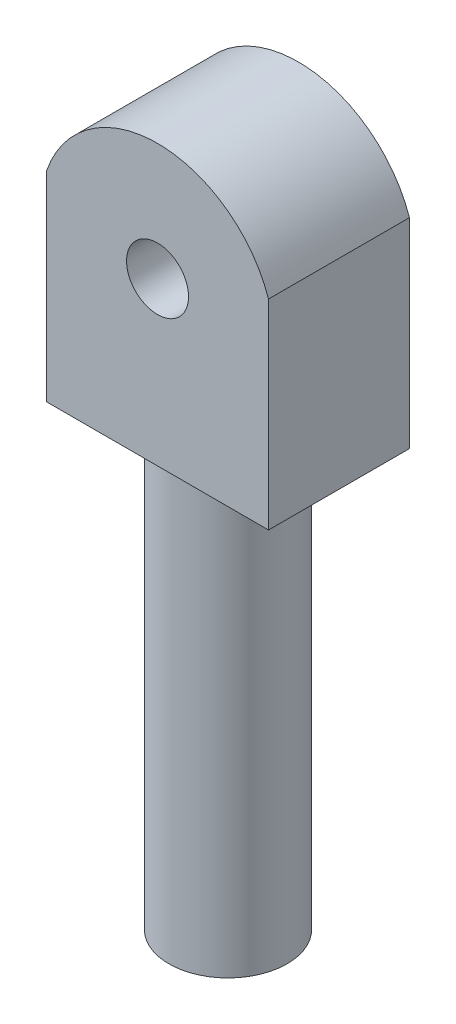
from build123d import *

# Parameters (mm, degrees)
SKETCH1_R           = 1.1176
BOSS_EXTRUDE1_DEPTH = 5.08
SKETCH2_R           = 1.0922
CUT_EXTRUDE1_DEPTH  = 15.748
SKETCH3_W           = 8.001
SKETCH3_H           = 5.08
SKETCH3_R           = 2.131785714
CUT_EXTRUDE2_DEPTH  = 15.748


with BuildPart() as part:
    # Sketch1 → Boss-Extrude1 (new body)
    with BuildSketch(Plane.XY):
        with BuildLine():
            Line((4.0005, -21.59), (4.0005, 1.368360053))
            ThreePointArc((4.0005, 1.368360053), (0, 4.228050317), (-4.0005, 1.368360053))
            Line((-4.0005, 1.368360053), (-4.0005, -21.59))
            Line((-4.0005, -21.59), (4.0005, -21.59))
        make_face()
        Circle(SKETCH1_R, mode=Mode.SUBTRACT)
    extrude(amount=BOSS_EXTRUDE1_DEPTH)

    # Sketch2 → Cut-Extrude1 (cut)
    with BuildSketch(Plane.XZ.offset(21.59)):
        with Locations(Location((0, 2.54, 0), (0, 0, 270))):
            Circle(SKETCH2_R)
    extrude(amount=-CUT_EXTRUDE1_DEPTH, mode=Mode.SUBTRACT)

    # Sketch3 → Cut-Extrude2 (cut)
    with BuildSketch(Plane.XZ.offset(21.59)):
        with Locations((0, 2.54)):
            Rectangle(SKETCH3_W, SKETCH3_H)
        with Locations(Location((0, 2.54, 0), (0, 0, 270))):
            Circle(SKETCH3_R, mode=Mode.SUBTRACT)
    extrude(amount=-CUT_EXTRUDE2_DEPTH, mode=Mode.SUBTRACT)


solid = part.part
